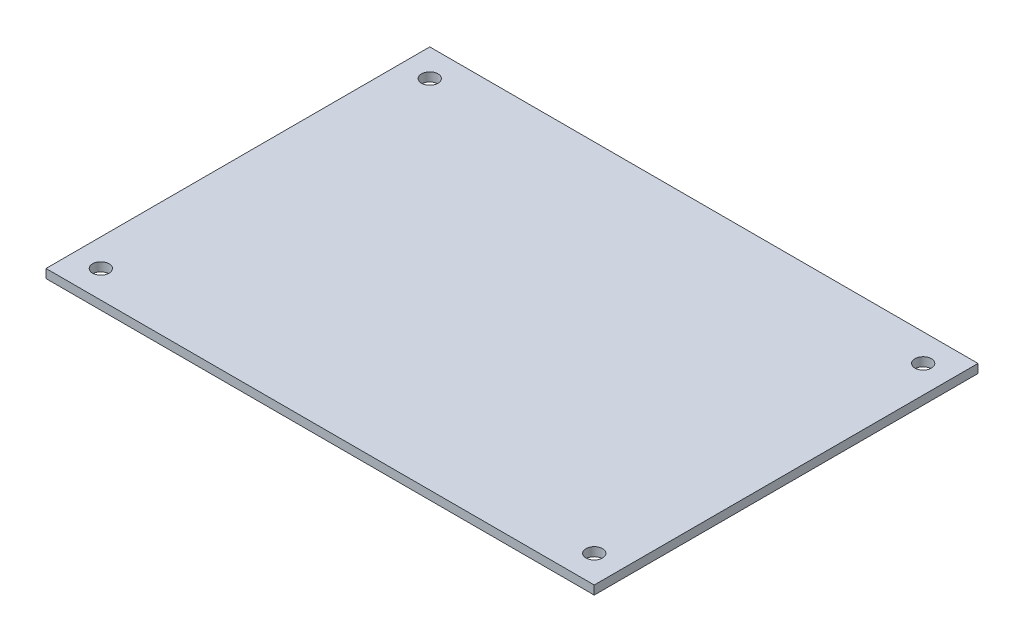
from build123d import *

# Parameters (mm, degrees)
SKETCH_1_W          = 100
SKETCH_1_H          = 70
EXTRUDE_1_DEPTH     = 1.6
SKETCH_2_R          = 1.5
CUT_EXTRUDE_1_DEPTH = 123.076041876


with BuildPart() as part:
    # 草图1 → 凸台-拉伸1 (new body)
    with BuildSketch(Plane(origin=(0, 0, 0), x_dir=(1, 0, 0), z_dir=(0, 1, 0))):
        with Locations((-50, 35)):
            Rectangle(SKETCH_1_W, SKETCH_1_H)
    extrude(amount=EXTRUDE_1_DEPTH)

    # 草图2 → 切除-拉伸1 (cut, through all)
    with BuildSketch(Plane(origin=(0, 1.6, 0), x_dir=(1, 0, 0), z_dir=(0, 1, 0))):
        with Locations(Location((-95, 65, 0), (0, 0, 270))):
            Circle(SKETCH_2_R)
        with Locations(Location((-95, 5, 0), (0, 0, 90))):
            Circle(SKETCH_2_R)
        with Locations(Location((-5, 5, 0), (0, 0, 270))):
            Circle(SKETCH_2_R)
        with Locations(Location((-5, 65, 0), (0, 0, 90))):
            Circle(SKETCH_2_R)
    extrude(amount=-CUT_EXTRUDE_1_DEPTH, mode=Mode.SUBTRACT)


solid = part.part
